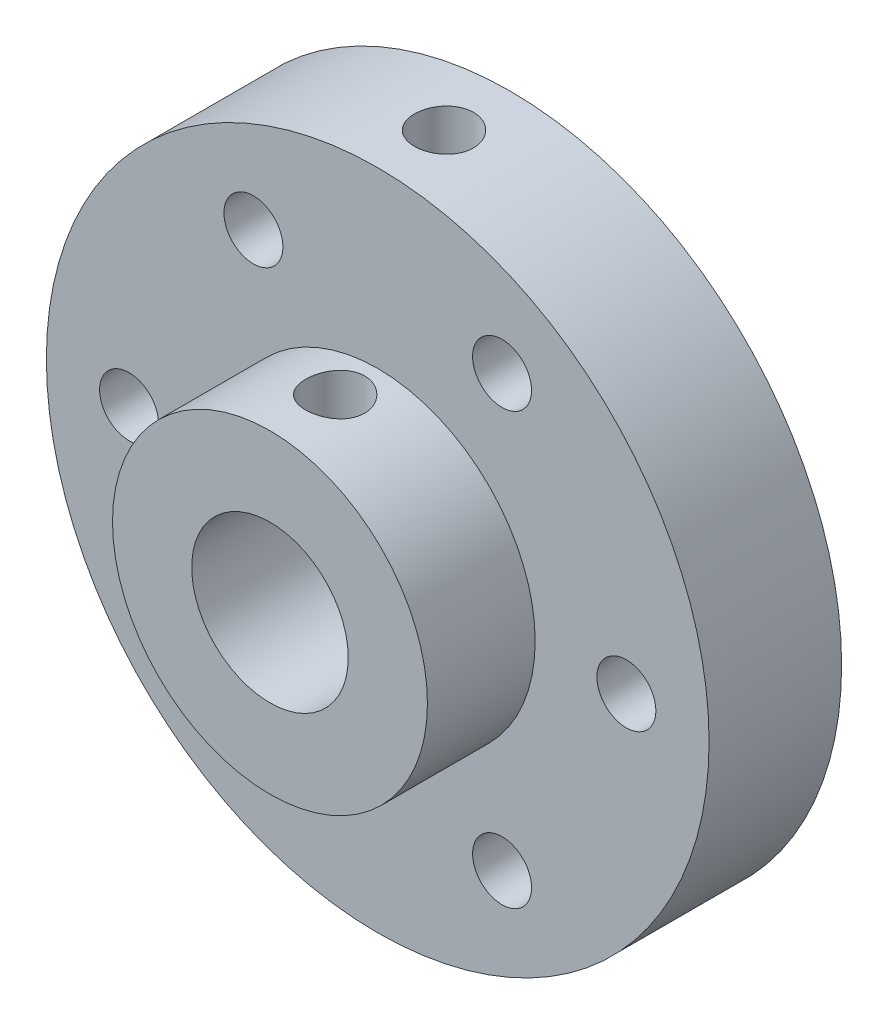
from build123d import *

# Parameters (mm, degrees)
CROQUIS3_R                  = 3
CORTAR_EXTRUIR1_DEPTH       = 21.184253764
TALADRO_ROSCADO_4_403_D     = 2.2606
TALADRO_ROSCADO_4_404_D     = 2.2606
TALADRO_ROSCADO_4_404_DEPTH = 12.699
TALADRO_ROSCADO_4_404_TIP   = 0.679152758


with BuildPart() as part:
    # Croquis2 → Revolución1 (revolve)
    with BuildSketch(Plane(origin=(0, 0, 0), x_dir=(0, 0, -1), z_dir=(1, 0, 0))):
        Polygon((0, 0), (0, 6.035), (4.13, 6.035), (4.13, 12.7), (9.21, 12.7), (9.21, 0), align=None)
    revolve(axis=Axis((0, 0, -9.21), (0, 0, 1)))

    # Croquis3 → Cortar-Extruir1 (cut, through all)
    with BuildSketch(Plane.XY):
        Circle(CROQUIS3_R)
    extrude(amount=-CORTAR_EXTRUIR1_DEPTH, mode=Mode.SUBTRACT)

    # Taladro roscado #4-403 (through all)
    with Locations(Plane.XY.offset(-4.13)):
        with Locations((-9.53, 0), (-4.765, 8.253222098), (4.765, 8.253222098), (9.53, 0), (4.765, -8.253222098), (-4.765, -8.253222098), (0, 0)):
            Hole(TALADRO_ROSCADO_4_403_D / 2)

    # Taladro roscado #4-404
    with Locations(Plane(origin=(0, 12.7, 0), x_dir=(1, 0, 0), z_dir=(0, 1, 0))):
        with Locations((0, 6.67), (0, 2.5)):
            Hole(TALADRO_ROSCADO_4_404_D / 2, depth=TALADRO_ROSCADO_4_404_DEPTH)
            with Locations((0, 0, -(TALADRO_ROSCADO_4_404_DEPTH + TALADRO_ROSCADO_4_404_TIP / 2))):  # 118° drill point
                Cone(0, TALADRO_ROSCADO_4_404_D / 2, TALADRO_ROSCADO_4_404_TIP, mode=Mode.SUBTRACT)


solid = part.part
